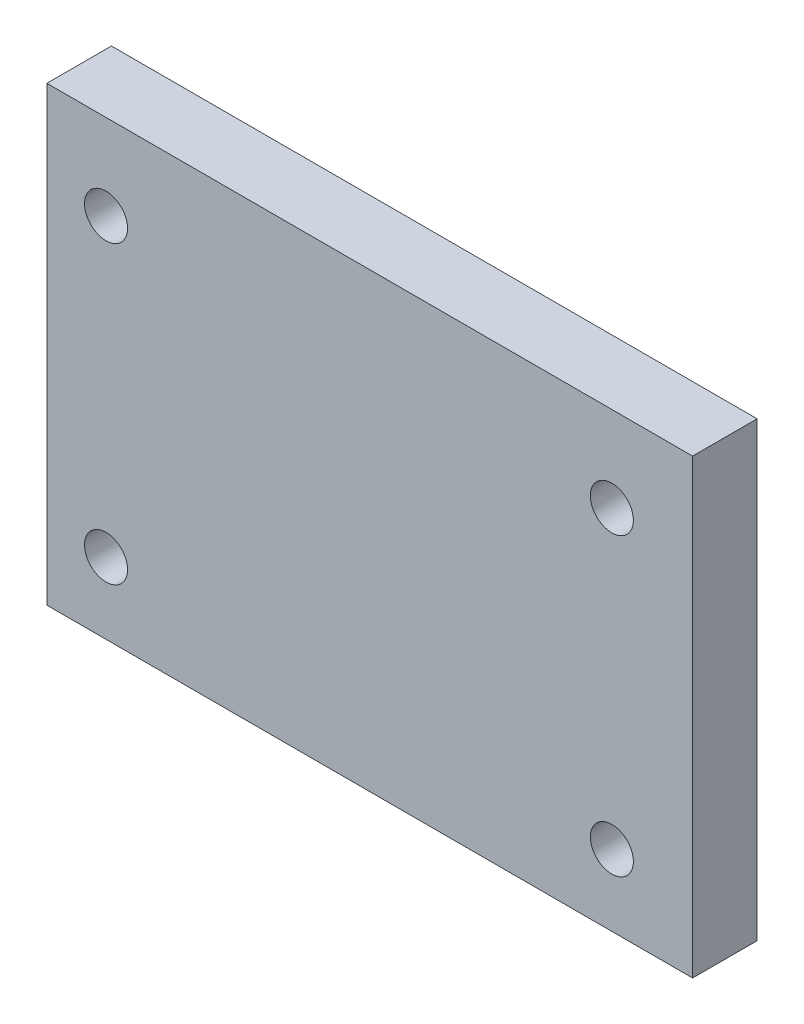
from build123d import *

# Parameters (mm, degrees)
ESQUISSE1_W             = 300
ESQUISSE1_H             = 210
BOSS_EXTRU_1_DEPTH      = 30
ESQUISSE2_R             = 10
ENL_V_MAT_EXTRU_1_DEPTH = 30


with BuildPart() as part:
    # Esquisse1 → Boss.-Extru.1 (new body)
    with BuildSketch(Plane.XY):
        with Locations((150, 105)):
            Rectangle(ESQUISSE1_W, ESQUISSE1_H)
    extrude(amount=BOSS_EXTRU_1_DEPTH)

    # Esquisse2 → Enlèv. mat.-Extru.1 (cut)
    with BuildSketch(Plane(origin=(0, 0, 0), x_dir=(-1, 0, 0), z_dir=(0, 0, -1))):
        with Locations((-27.5, 33.055885432)):
            Circle(ESQUISSE2_R)
        with Locations((-27.5, 170.355885432)):
            Circle(ESQUISSE2_R)
        with Locations((-262.500000473, 170.355885432)):
            Circle(ESQUISSE2_R)
        with Locations((-262.500000473, 33.055885432)):
            Circle(ESQUISSE2_R)
    extrude(amount=-ENL_V_MAT_EXTRU_1_DEPTH, mode=Mode.SUBTRACT)


solid = part.part
